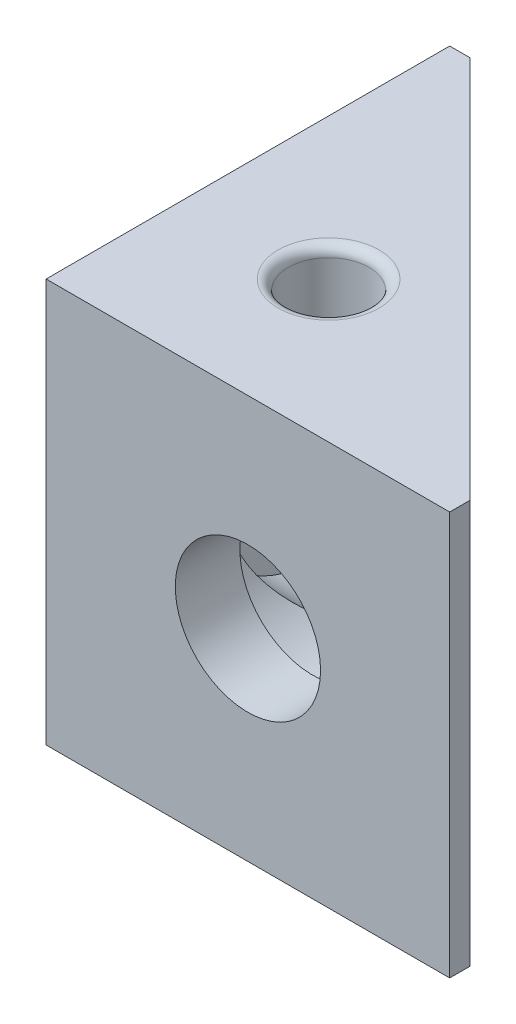
from build123d import *

# Parameters (mm, degrees)
BOSS_EXTRUDE1_DEPTH = 10
CUT_EXTRUDE1_REACH  = 32
SKETCH3_R           = 3.6
CUT_EXTRUDE3_REACH  = 39.344
CUT_EXTRUDE3_START  = -3.2
SKETCH3_4_R         = 5.5
SKETCH3_4_R_2       = 3.6
CUT_EXTRUDE2_REACH  = 32
SKETCH4_R           = 3.6
CUT_EXTRUDE4_REACH  = 35.2
CUT_EXTRUDE4_START  = -3.2
SKETCH4_3_R         = 5.5
SKETCH4_3_R_2       = 3.6
SKETCH5_R           = 2
CUT_EXTRUDE5_DEPTH  = 4.5
FILLET1_R           = 0.5


with BuildPart() as part:
    # Sketch2 → Boss-Extrude1 (new, symmetric)
    with BuildSketch(Plane(origin=(0, 0, 0), x_dir=(1, 0, 0), z_dir=(0, 1, 0))):
        Polygon((0, 0), (0, 20), (1, 20), (20, 1), (20, 0), align=None)
    extrude(amount=BOSS_EXTRUDE1_DEPTH, both=True)

    # Cut-Extrude1: up to this plane
    cut_extrude1_end = Plane(origin=(1, 10, -20), z_dir=(-0.7071067811865476, 0, 0.7071067811865476))
    # Sketch3 → Cut-Extrude1 (cut, up to the surface)
    with BuildSketch(Plane.XY, mode=Mode.PRIVATE) as cut_extrude1_sk1:
        with Locations((10, 0)):
            Circle(SKETCH3_R)
    cut_extrude1_tool1 = split(extrude(cut_extrude1_sk1.sketch, amount=-CUT_EXTRUDE1_REACH, mode=Mode.PRIVATE), bisect_by=cut_extrude1_end, keep=Keep.BOTH, mode=Mode.PRIVATE)
    add(cut_extrude1_tool1.solids().sort_by_distance((10, 0, 0))[0], mode=Mode.SUBTRACT)

    # Cut-Extrude3: up to this plane
    cut_extrude3_end = Plane(origin=(1, 10, -20), z_dir=(-0.7071067811865476, 0, 0.7071067811865476))
    # Sketch3<4> → Cut-Extrude3 (cut, up to the surface)
    with BuildSketch(Plane.XY.offset(CUT_EXTRUDE3_START), mode=Mode.PRIVATE) as cut_extrude3_sk1:
        with Locations((10, 0)):
            Circle(SKETCH3_4_R)
        with Locations((10, 0)):
            Circle(SKETCH3_4_R_2, mode=Mode.SUBTRACT)
    cut_extrude3_tool1 = split(extrude(cut_extrude3_sk1.sketch, amount=-CUT_EXTRUDE3_REACH, mode=Mode.PRIVATE), bisect_by=cut_extrude3_end, keep=Keep.BOTH, mode=Mode.PRIVATE)
    add(cut_extrude3_tool1.solids().sort_by_distance((4.655563, 0, -3.2))[0], mode=Mode.SUBTRACT)

    # Cut-Extrude2: up to this plane
    cut_extrude2_end = Plane(origin=(1, 10, -20), z_dir=(-0.7071067811865476, 0, 0.7071067811865476))
    # Sketch4 → Cut-Extrude2 (cut, up to the surface)
    with BuildSketch(Plane.ZY, mode=Mode.PRIVATE) as cut_extrude2_sk1:
        with Locations((-10, 0)):
            Circle(SKETCH4_R)
    cut_extrude2_tool1 = split(extrude(cut_extrude2_sk1.sketch, amount=-CUT_EXTRUDE2_REACH, mode=Mode.PRIVATE), bisect_by=cut_extrude2_end, keep=Keep.BOTH, mode=Mode.PRIVATE)
    add(cut_extrude2_tool1.solids().sort_by_distance((0, 0, -10))[0], mode=Mode.SUBTRACT)

    # Cut-Extrude4: up to this plane
    cut_extrude4_end = Plane(origin=(1, 10, -20), z_dir=(-0.7071067811865476, 0, 0.7071067811865476))
    # Sketch4<3> → Cut-Extrude4 (cut, up to the surface)
    with BuildSketch(Plane.ZY.offset(CUT_EXTRUDE4_START), mode=Mode.PRIVATE) as cut_extrude4_sk1:
        with Locations((-10, 0)):
            Circle(SKETCH4_3_R)
        with Locations((-10, 0)):
            Circle(SKETCH4_3_R_2, mode=Mode.SUBTRACT)
    cut_extrude4_tool1 = split(extrude(cut_extrude4_sk1.sketch, amount=-CUT_EXTRUDE4_REACH, mode=Mode.PRIVATE), bisect_by=cut_extrude4_end, keep=Keep.BOTH, mode=Mode.PRIVATE)
    add(cut_extrude4_tool1.solids().sort_by_distance((3.2, 0, -15.344437))[0], mode=Mode.SUBTRACT)

    # Sketch5 → Cut-Extrude5 (cut)
    with BuildSketch(Plane(origin=(0, 10, 0), x_dir=(1, 0, 0), z_dir=(0, 1, 0))):
        with Locations((7, 7)):
            Circle(SKETCH5_R)
    extrude(amount=-CUT_EXTRUDE5_DEPTH, mode=Mode.SUBTRACT)

    # Fillet1
    fillet1_edges = [part.edges().sort_by_distance(p)[0] for p in [
        (5, 10, -7),
    ]]
    fillet(fillet1_edges, radius=FILLET1_R)


solid = part.part
